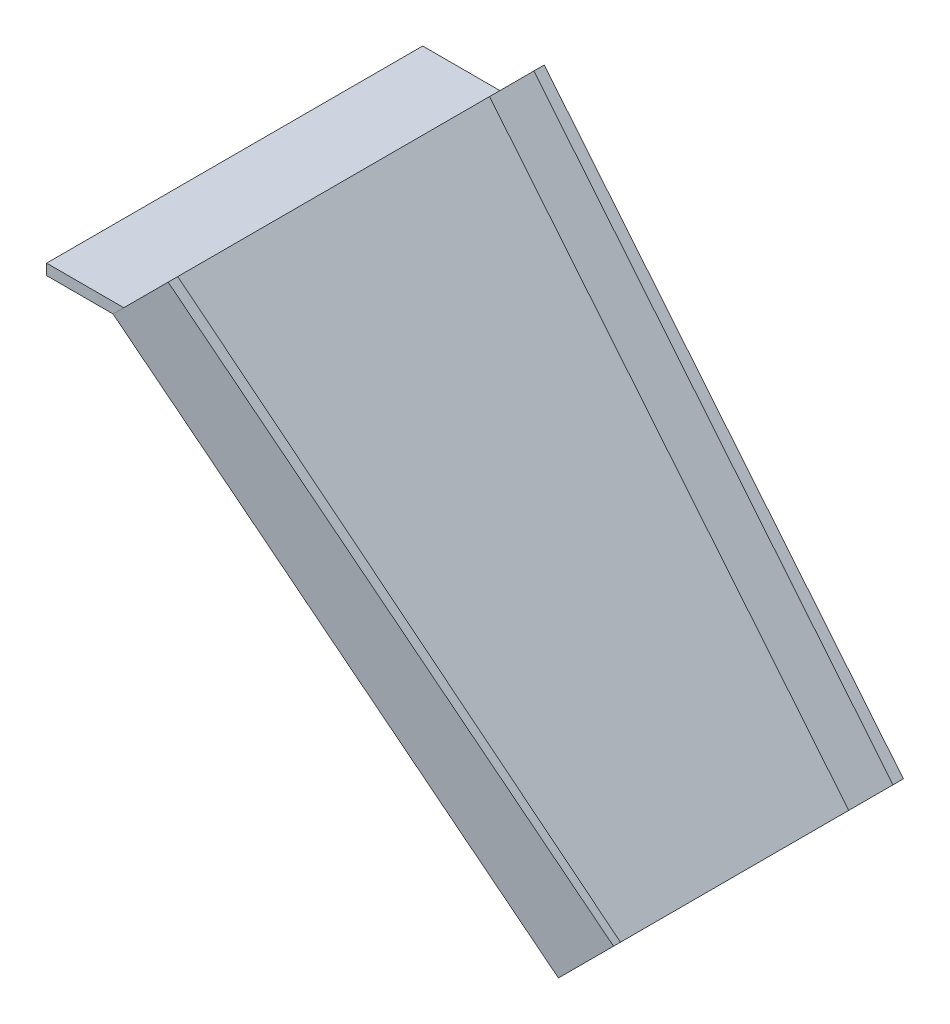
from build123d import *

# Parameters (mm, degrees)
BOSS_EXTRUDE1_DEPTH          = 60
CUT_EXTRUDE_THIN3_DEPTH      = 82.68933693
CUT_EXTRUDE_THIN3_DEPTH_BACK = 82.68933693
CUT_EXTRUDE_THIN4_DEPTH      = 82.68933693
CUT_EXTRUDE_THIN4_DEPTH_BACK = 82.68933693
BOSS_EXTRUDE4_DEPTH          = 10
BOSS_EXTRUDE5_DEPTH          = 10


with BuildPart() as part:
    # Sketch1 → Boss-Extrude1 (new body)
    with BuildSketch(Plane.XY):
        Polygon((-31.819805153, 31.819805153), (31.819805153, -31.819805153), (30.097767276, -33.541843031), (-33.541843031, 30.097767276), (-44.137201249, 30.097767276), (-44.137201249, 31.819805153), align=None)
    extrude(amount=BOSS_EXTRUDE1_DEPTH)

    # Sketch6 → Cut-Extrude-Thin3 (cut, two sides: drawn at the far end of the back side and taken through both)
    with BuildSketch(Plane(origin=(0, 0, 0), x_dir=(0.7071067811865561, -0.7071067811865389, 0), z_dir=(0.7071067811865389, 0.7071067811865561, 0)).offset(-CUT_EXTRUDE_THIN3_DEPTH_BACK)):
        Polygon((-45, -60), (45, -52.5774462), (86.096881173, -550.885630317), (-3.903118827, -558.308184117), align=None)
    extrude(amount=CUT_EXTRUDE_THIN3_DEPTH + CUT_EXTRUDE_THIN3_DEPTH_BACK, mode=Mode.SUBTRACT)

    # Sketch7 → Cut-Extrude-Thin4 (cut, two sides: drawn at the far end of the back side and taken through both)
    with BuildSketch(Plane(origin=(0, 0, 0), x_dir=(0.7071067811865561, -0.7071067811865389, 0), z_dir=(0.7071067811865389, 0.7071067811865561, 0)).offset(-CUT_EXTRUDE_THIN4_DEPTH_BACK)):
        Polygon((-45, 0), (45, -6.337900888), (80.123576931, 492.426907757), (-9.876423069, 498.764808646), align=None)
    extrude(amount=CUT_EXTRUDE_THIN4_DEPTH + CUT_EXTRUDE_THIN4_DEPTH_BACK, mode=Mode.SUBTRACT)

    # Sketch8 → Boss-Extrude4 (add)
    with BuildSketch(Plane(origin=(0, 0, 0), x_dir=(0, 0, -1), z_dir=(0.7071067811865389, 0.7071067811865561, 0))):
        Polygon((-60, 45), (-58.467214774, 45), (-51.473114592, -45), (-52.5774462, -45), align=None)
    extrude(amount=BOSS_EXTRUDE4_DEPTH)

    # Sketch9 → Boss-Extrude5 (add)
    with BuildSketch(Plane(origin=(0, 0, 0), x_dir=(0, 0, -1), z_dir=(0.7071067811865389, 0.7071067811865561, 0))):
        Polygon((-6.337900888, -45), (0, 45), (-1.653616098, 45), (-7.991516987, -45), align=None)
    extrude(amount=BOSS_EXTRUDE5_DEPTH)


solid = part.part
